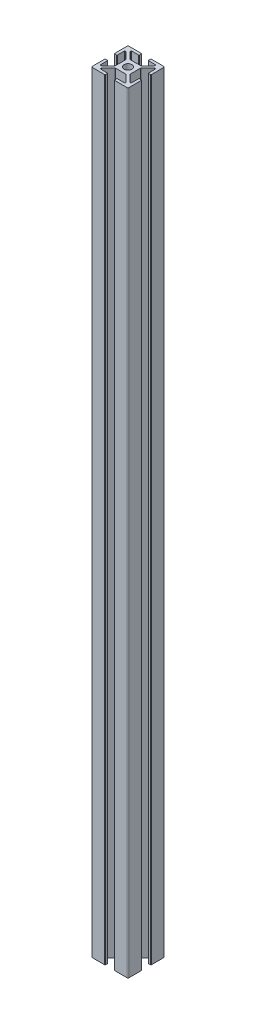
from build123d import *

# Parameters (mm, degrees)
SKETCH_1_R      = 2.15
EXTRUDE_1_DEPTH = 420


with BuildPart() as part:
    # Эскиз1 → Бобышка-Вытянуть1 (new body)
    with BuildSketch(Plane(origin=(0, 0, 210), x_dir=(1, 0, 0), z_dir=(0, -1, 0))):
        with BuildLine():
            Line((-10, -2.75), (-10, -9.5))
            ThreePointArc((-10, -9.5), (-9.853553391, -9.853553391), (-9.5, -10))
            Line((-9.5, -10), (-2.75, -10))
            ThreePointArc((-2.75, -10), (-2.573223305, -9.926776695), (-2.5, -9.75))
            Line((-2.5, -9.75), (-2.5, -8.75))
            ThreePointArc((-2.5, -8.75), (-2.573223305, -8.573223305), (-2.75, -8.5))
            Line((-2.75, -8.5), (-6.5, -8.5))
            ThreePointArc((-6.5, -8.5), (-6.676776695, -8.426776695), (-6.75, -8.25))
            Line((-6.75, -8.25), (-6.75, -7.914213562))
            ThreePointArc((-6.75, -7.914213562), (-6.730969883, -7.818542704), (-6.676776695, -7.737436867))
            Line((-6.676776695, -7.737436867), (-3.085786438, -4.146446609))
            ThreePointArc((-3.085786438, -4.146446609), (-2.923574763, -4.038060234), (-2.732233047, -4))
            Line((-2.732233047, -4), (2.732233047, -4))
            ThreePointArc((2.732233047, -4), (2.923574763, -4.038060234), (3.085786438, -4.146446609))
            Line((3.085786438, -4.146446609), (6.676776695, -7.737436867))
            ThreePointArc((6.676776695, -7.737436867), (6.730969883, -7.818542704), (6.75, -7.914213562))
            Line((6.75, -7.914213562), (6.75, -8.25))
            ThreePointArc((6.75, -8.25), (6.676776695, -8.426776695), (6.5, -8.5))
            Line((6.5, -8.5), (2.75, -8.5))
            ThreePointArc((2.75, -8.5), (2.573223305, -8.573223305), (2.5, -8.75))
            Line((2.5, -8.75), (2.5, -9.75))
            ThreePointArc((2.5, -9.75), (2.573223305, -9.926776695), (2.75, -10))
            Line((2.75, -10), (9.5, -10))
            ThreePointArc((9.5, -10), (9.853553391, -9.853553391), (10, -9.5))
            Line((10, -9.5), (10, -2.75))
            ThreePointArc((10, -2.75), (9.926776695, -2.573223305), (9.75, -2.5))
            Line((9.75, -2.5), (8.75, -2.5))
            ThreePointArc((8.75, -2.5), (8.573223305, -2.573223305), (8.5, -2.75))
            Line((8.5, -2.75), (8.5, -6.5))
            ThreePointArc((8.5, -6.5), (8.426776695, -6.676776695), (8.25, -6.75))
            Line((8.25, -6.75), (7.914213562, -6.75))
            ThreePointArc((7.914213562, -6.75), (7.818542704, -6.730969883), (7.737436867, -6.676776695))
            Line((7.737436867, -6.676776695), (4.146446609, -3.085786438))
            ThreePointArc((4.146446609, -3.085786438), (4.038060234, -2.923574763), (4, -2.732233047))
            Line((4, -2.732233047), (4, 2.732233047))
            ThreePointArc((4, 2.732233047), (4.038060234, 2.923574763), (4.146446609, 3.085786438))
            Line((4.146446609, 3.085786438), (7.737436867, 6.676776695))
            ThreePointArc((7.737436867, 6.676776695), (7.818542704, 6.730969883), (7.914213562, 6.75))
            Line((7.914213562, 6.75), (8.25, 6.75))
            ThreePointArc((8.25, 6.75), (8.426776695, 6.676776695), (8.5, 6.5))
            Line((8.5, 6.5), (8.5, 2.75))
            ThreePointArc((8.5, 2.75), (8.573223305, 2.573223305), (8.75, 2.5))
            Line((8.75, 2.5), (9.75, 2.5))
            ThreePointArc((9.75, 2.5), (9.926776695, 2.573223305), (10, 2.75))
            Line((10, 2.75), (10, 9.5))
            ThreePointArc((10, 9.5), (9.853553391, 9.853553391), (9.5, 10))
            Line((9.5, 10), (2.75, 10))
            ThreePointArc((2.75, 10), (2.573223305, 9.926776695), (2.5, 9.75))
            Line((2.5, 9.75), (2.5, 8.75))
            ThreePointArc((2.5, 8.75), (2.573223305, 8.573223305), (2.75, 8.5))
            Line((2.75, 8.5), (6.5, 8.5))
            ThreePointArc((6.5, 8.5), (6.676776695, 8.426776695), (6.75, 8.25))
            Line((6.75, 8.25), (6.75, 7.810660172))
            Line((6.75, 7.810660172), (3.012563133, 4.073223305))
            ThreePointArc((3.012563133, 4.073223305), (2.931457296, 4.019030117), (2.835786438, 4))
            Line((2.835786438, 4), (-2.732233047, 4))
            ThreePointArc((-2.732233047, 4), (-2.923574763, 4.038060234), (-3.085786438, 4.146446609))
            Line((-3.085786438, 4.146446609), (-6.676776695, 7.737436867))
            ThreePointArc((-6.676776695, 7.737436867), (-6.730969883, 7.818542704), (-6.75, 7.914213562))
            Line((-6.75, 7.914213562), (-6.75, 8.25))
            ThreePointArc((-6.75, 8.25), (-6.676776695, 8.426776695), (-6.5, 8.5))
            Line((-6.5, 8.5), (-2.75, 8.5))
            ThreePointArc((-2.75, 8.5), (-2.573223305, 8.573223305), (-2.5, 8.75))
            Line((-2.5, 8.75), (-2.5, 9.75))
            ThreePointArc((-2.5, 9.75), (-2.573223305, 9.926776695), (-2.75, 10))
            Line((-2.75, 10), (-9.5, 10))
            ThreePointArc((-9.5, 10), (-9.853553391, 9.853553391), (-10, 9.5))
            Line((-10, 9.5), (-10, 2.75))
            ThreePointArc((-10, 2.75), (-9.926776695, 2.573223305), (-9.75, 2.5))
            Line((-9.75, 2.5), (-8.75, 2.5))
            ThreePointArc((-8.75, 2.5), (-8.573223305, 2.573223305), (-8.5, 2.75))
            Line((-8.5, 2.75), (-8.5, 6.5))
            ThreePointArc((-8.5, 6.5), (-8.426776695, 6.676776695), (-8.25, 6.75))
            Line((-8.25, 6.75), (-7.914213562, 6.75))
            ThreePointArc((-7.914213562, 6.75), (-7.818542704, 6.730969883), (-7.737436867, 6.676776695))
            Line((-7.737436867, 6.676776695), (-4.146446609, 3.085786438))
            ThreePointArc((-4.146446609, 3.085786438), (-4.038060234, 2.923574763), (-4, 2.732233047))
            Line((-4, 2.732233047), (-4, -2.732233047))
            ThreePointArc((-4, -2.732233047), (-4.038060234, -2.923574763), (-4.146446609, -3.085786438))
            Line((-4.146446609, -3.085786438), (-7.737436867, -6.676776695))
            ThreePointArc((-7.737436867, -6.676776695), (-7.818542704, -6.730969883), (-7.914213562, -6.75))
            Line((-7.914213562, -6.75), (-8.25, -6.75))
            ThreePointArc((-8.25, -6.75), (-8.426776695, -6.676776695), (-8.5, -6.5))
            Line((-8.5, -6.5), (-8.5, -2.75))
            ThreePointArc((-8.5, -2.75), (-8.573223305, -2.573223305), (-8.75, -2.5))
            Line((-8.75, -2.5), (-9.75, -2.5))
            ThreePointArc((-9.75, -2.5), (-9.926776695, -2.573223305), (-10, -2.75))
        make_face()
        with Locations(Location((0, 0, 0), (0, 0, 90))):
            Circle(SKETCH_1_R, mode=Mode.SUBTRACT)
    extrude(amount=-EXTRUDE_1_DEPTH)


solid = part.part
